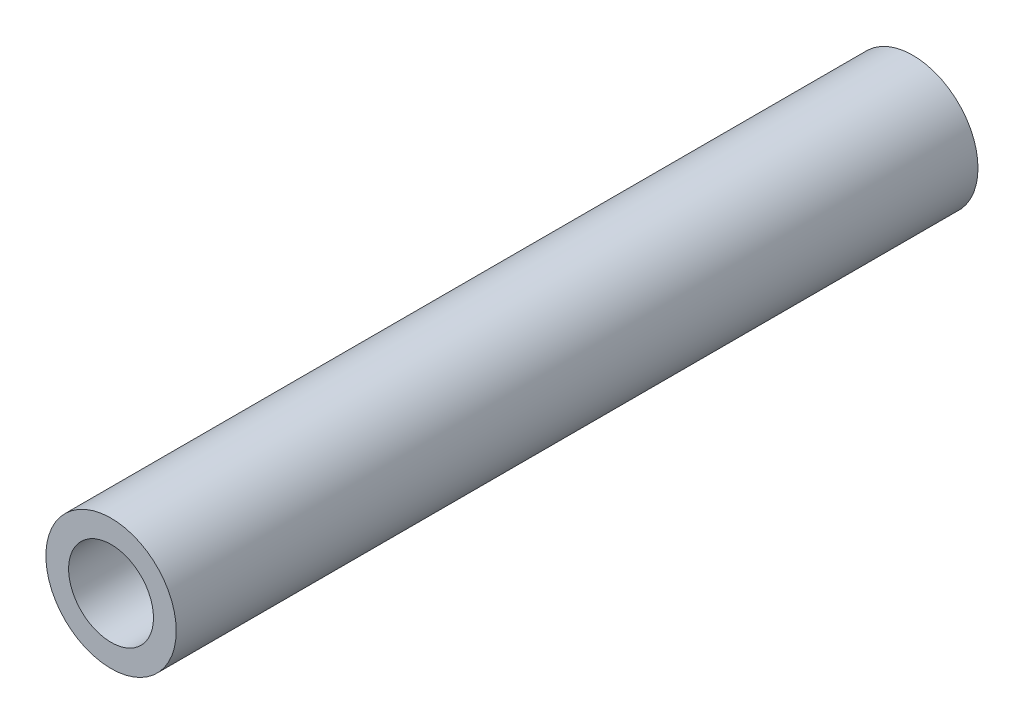
from build123d import *

# Parameters (mm, degrees)
SKETCH1_R           = 4.3
SKETCH1_R_2         = 2.8
BOSS_EXTRUDE1_DEPTH = 52.9


with BuildPart() as part:
    # Sketch1 → Boss-Extrude1 (new body)
    with BuildSketch(Plane.XY):
        with Locations((-8.5, 74.4)):
            Circle(SKETCH1_R)
        with Locations((-8.5, 74.4)):
            Circle(SKETCH1_R_2, mode=Mode.SUBTRACT)
    extrude(amount=BOSS_EXTRUDE1_DEPTH)


solid = part.part
